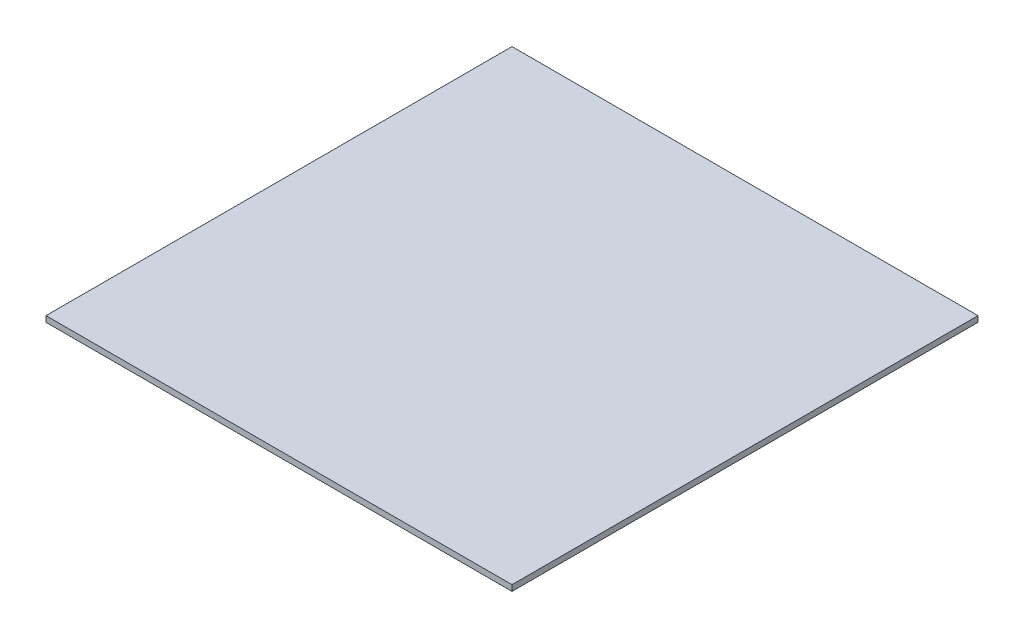
from build123d import *

# Parameters (mm, degrees)
SKETCH1_W           = 120
SKETCH1_H           = 120
BOSS_EXTRUDE1_DEPTH = 1.5


with BuildPart() as part:
    # Sketch1 → Boss-Extrude1 (new body)
    with BuildSketch(Plane(origin=(0, 0, 0), x_dir=(1, 0, 0), z_dir=(0, 1, 0))):
        with Locations((60, 60)):
            Rectangle(SKETCH1_W, SKETCH1_H)
    extrude(amount=BOSS_EXTRUDE1_DEPTH)


solid = part.part
